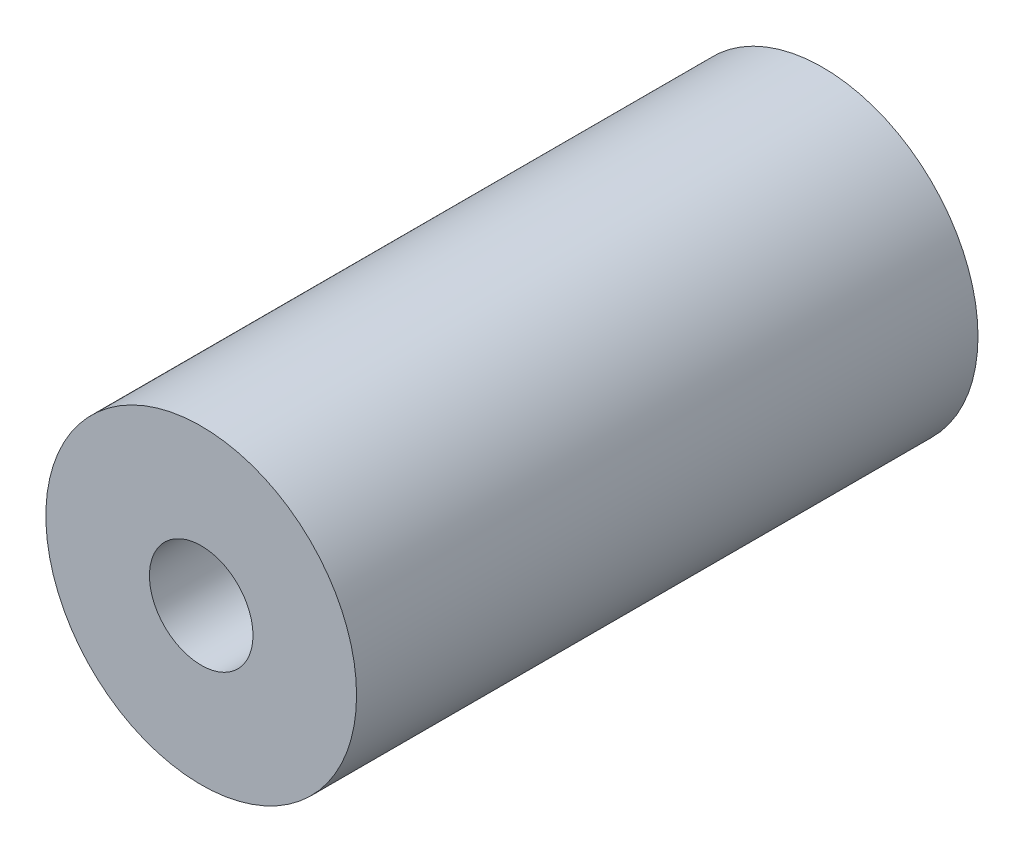
from build123d import *

# Parameters (mm, degrees)
SKETCH1_R           = 15
SKETCH1_R_2         = 5
BOSS_EXTRUDE1_DEPTH = 60


with BuildPart() as part:
    # Sketch1 → Boss-Extrude1 (new body)
    with BuildSketch(Plane.XY):
        Circle(SKETCH1_R)
        Circle(SKETCH1_R_2, mode=Mode.SUBTRACT)
    extrude(amount=-BOSS_EXTRUDE1_DEPTH)


solid = part.part
